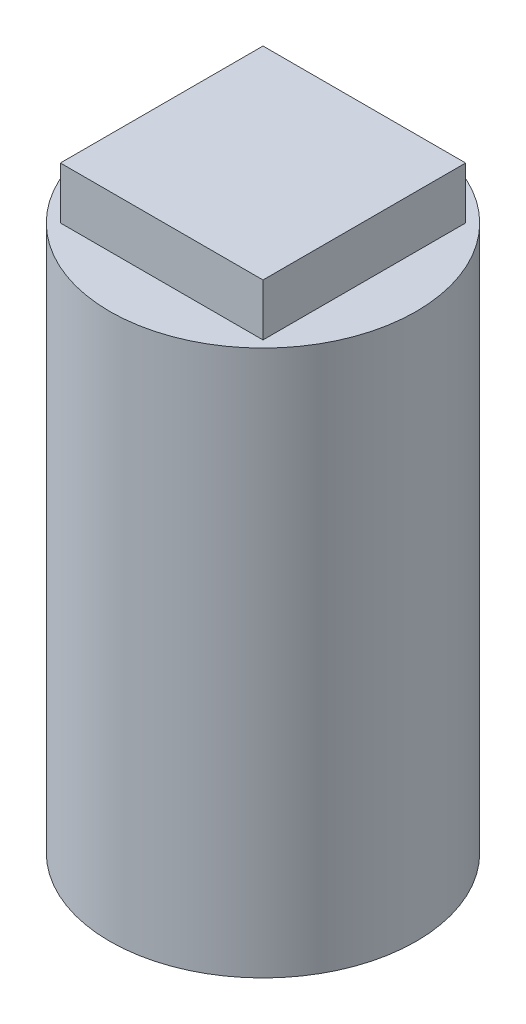
from build123d import *

# Parameters (mm, degrees)
SKETCH1_R           = 2.95
BOSS_EXTRUDE1_DEPTH = 10.5
SKETCH2_W           = 3.9
SKETCH2_H           = 3.9
BOSS_EXTRUDE3_DEPTH = 1


with BuildPart() as part:
    # Sketch1 → Boss-Extrude1 (new body)
    with BuildSketch(Plane(origin=(0, 0, 0), x_dir=(1, 0, 0), z_dir=(0, 1, 0))):
        with Locations(Location((0, 0, 0), (0, 0, 90))):
            Circle(SKETCH1_R)
    extrude(amount=BOSS_EXTRUDE1_DEPTH)

    # Sketch2 → Boss-Extrude3 (add)
    with BuildSketch(Plane(origin=(0, 10.5, 0), x_dir=(1, 0, 0), z_dir=(0, 1, 0))):
        Rectangle(SKETCH2_W, SKETCH2_H)
    extrude(amount=BOSS_EXTRUDE3_DEPTH)


solid = part.part
